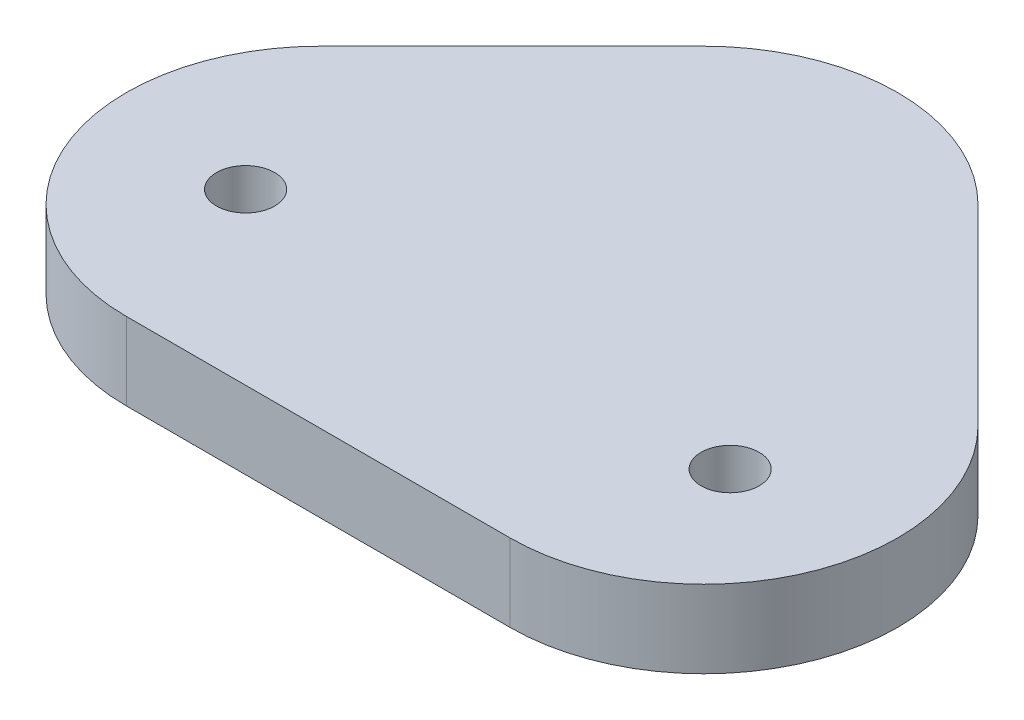
from build123d import *

# Parameters (mm, degrees)
AUFSATZ_LINEAR_AUSTRAGEN1_DEPTH = 4
SKIZZE4_R                       = 1.5
SCHNITT_LINEAR_AUSTRAGEN4_DEPTH = 4


with BuildPart() as part:
    # Skizze2 → Aufsatz-Linear austragen1 (new body)
    with BuildSketch(Plane(origin=(0, 0, 0), x_dir=(1, 0, 0), z_dir=(0, 1, 0))):
        with BuildLine():
            Line((26.970562748, 26.970562748), (17.071067812, 17.071067812))
            ThreePointArc((17.071067812, 17.071067812), (14.903340299, 6.173165676), (24.142135624, 0))
            Line((24.142135624, 0), (43.941125497, 0))
            ThreePointArc((43.941125497, 0), (53.179920822, 6.173165676), (51.012193309, 17.071067812))
            Line((51.012193309, 17.071067812), (41.112698372, 26.970562748))
            ThreePointArc((41.112698372, 26.970562748), (34.04163056, 29.899494937), (26.970562748, 26.970562748))
        make_face()
    extrude(amount=AUFSATZ_LINEAR_AUSTRAGEN1_DEPTH)

    # Skizze4 → Schnitt-Linear austragen4 (cut)
    with BuildSketch(Plane(origin=(0, 0, 0), x_dir=(1, 0, 0), z_dir=(0, 1, 0))):
        with Locations(Location((21.54163056, 8.754981608, 0), (0, 0, 90))):
            Circle(SKIZZE4_R)
        with Locations(Location((46.54163056, 8.754981608, 0), (0, 0, 90))):
            Circle(SKIZZE4_R)
    extrude(amount=SCHNITT_LINEAR_AUSTRAGEN4_DEPTH, mode=Mode.SUBTRACT)


solid = part.part
